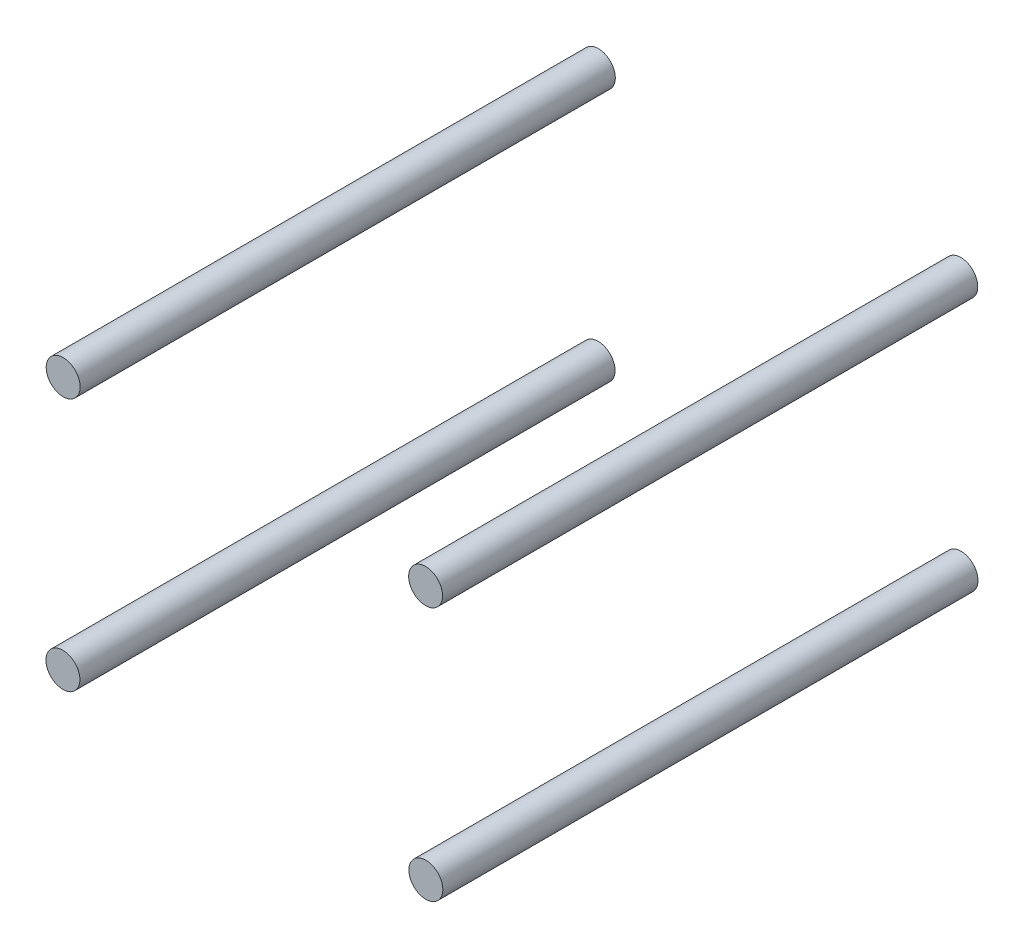
from build123d import *

# Parameters (mm, degrees)
SKETCH1_R             = 2.921000021
BOSS_EXTRUDE1_DEPTH   = 92.11056
BOSS_EXTRUDE1_2_DEPTH = 92.11056
BOSS_EXTRUDE1_3_DEPTH = 92.11056
BOSS_EXTRUDE1_4_DEPTH = 92.11056


with BuildPart() as part:
    # Sketch1 → Boss-Extrude1 (new body)
    with BuildSketch(Plane.XY):
        with Locations((6450.375628139, 3611.580736302)):
            Circle(SKETCH1_R)
    extrude(amount=BOSS_EXTRUDE1_DEPTH)


with BuildPart() as body_2:
    # Sketch1 → Boss-Extrude1 2 (new body)
    with BuildSketch(Plane.XY):
        with Locations((6512.835771472, 3611.522413231)):
            Circle(SKETCH1_R)
    extrude(amount=BOSS_EXTRUDE1_2_DEPTH)


with BuildPart() as body_3:
    # Sketch1 → Boss-Extrude1 3 (new body)
    with BuildSketch(Plane.XY):
        with Locations((6512.794158395, 3655.2882475)):
            Circle(SKETCH1_R)
    extrude(amount=BOSS_EXTRUDE1_3_DEPTH)


with BuildPart() as body_4:
    # Sketch1 → Boss-Extrude1 4 (new body)
    with BuildSketch(Plane.XY):
        with Locations((6450.416385285, 3655.22893797)):
            Circle(SKETCH1_R)
    extrude(amount=BOSS_EXTRUDE1_4_DEPTH)


solid = Compound([part.part, body_2.part, body_3.part, body_4.part])
